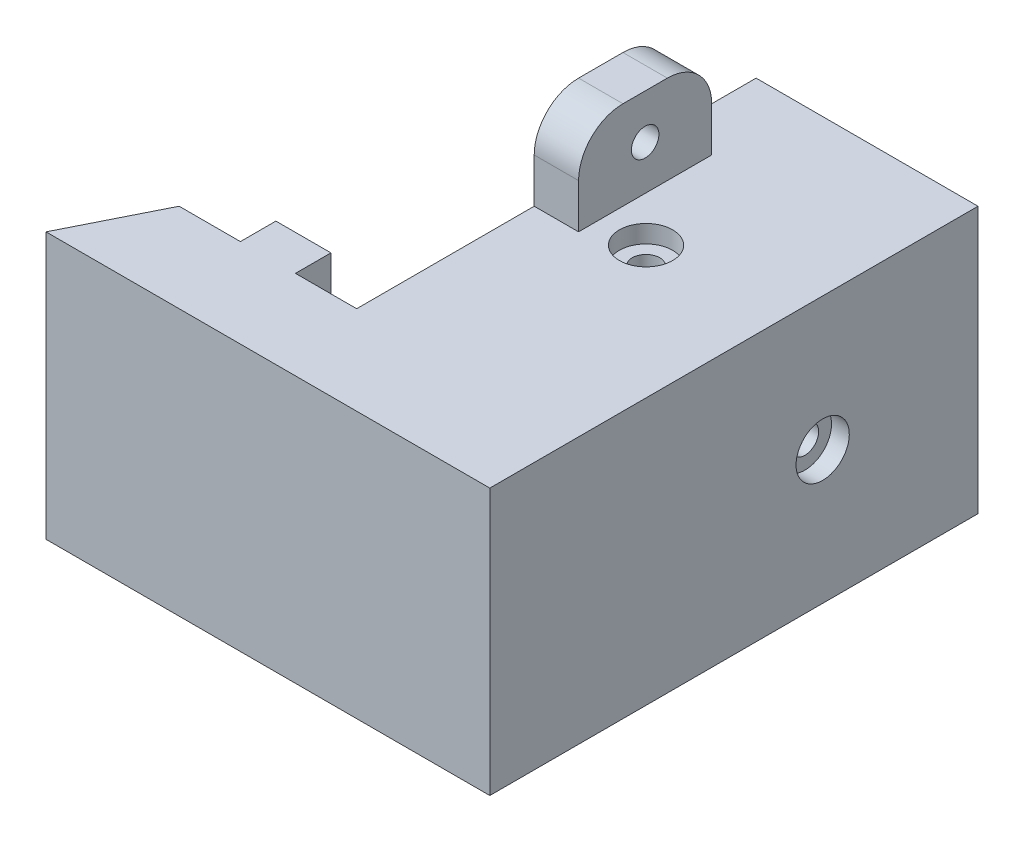
from build123d import *

# Parameters (mm, degrees)
EXTRUDE_1_DEPTH      = 14
CUT_EXTRUDE_1_DEPTH  = 44
SKETCH_8_W           = 5
SKETCH_8_H           = 44
CUT_EXTRUDE_2_DEPTH  = 10
SKETCH_9_W           = 25
SKETCH_9_H           = 44
EXTRUDE_2_DEPTH      = 10
SKETCH_10_W          = 50
SKETCH_10_H          = 7
CUT_EXTRUDE_3_DEPTH  = 10
SKETCH_11_W          = 6.2
SKETCH_11_H          = 7
CUT_EXTRUDE_4_DEPTH  = 10
SKETCH_12_W          = 5
SKETCH_12_H          = 5
SKETCH_12_W_2        = 20
SKETCH_12_H_2        = 20
EXTRUDE_3_DEPTH      = 45
SKETCH_13_W          = 5
SKETCH_13_H          = 7.5
EXTRUDE_4_DEPTH      = 10
SKETCH_14_W          = 15
SKETCH_14_H          = 10
EXTRUDE_5_DEPTH      = 5
SKETCH_15_R          = 1.55
CUT_EXTRUDE_5_DEPTH  = 5
CUT_EXTRUDE_6_DEPTH  = 5
CUT_EXTRUDE_7_DEPTH  = 5
EXTRUDE_6_DEPTH      = 5
EXTRUDE_START        = -5
EXTRUDE_7_DEPTH      = 5
SKETCH_20_W          = 0.2
SKETCH_20_H          = 20
CUT_EXTRUDE_8_DEPTH  = 45
CUT_EXTRUDE_START    = -100
CUT_EXTRUDE_9_DEPTH  = 100
CUT_EXTRUDE_10_DEPTH = 100
SKETCH_24_R          = 1.55
CUT_EXTRUDE_11_DEPTH = 100
SKETCH_25_R          = 3
SKETCH_25_R_2        = 1.55
CUT_EXTRUDE_12_DEPTH = 2
CUT_EXTRUDE_START_2  = -2
SKETCH_26_R          = 3
CUT_EXTRUDE_13_DEPTH = 2
CUT_EXTRUDE_14_DEPTH = 5
SKETCH_28_R          = 3
CUT_EXTRUDE_15_DEPTH = 2


with BuildPart() as part:
    # 草图1 → 凸台-拉伸1 (new body)
    with BuildSketch(Plane.XY):
        Polygon((-15, 22), (-15, -22), (15, -22), (15, 22), (0, 22), align=None)
    extrude(amount=EXTRUDE_1_DEPTH)

    # 草图2 → 切除-拉伸1 (cut)
    with BuildSketch(Plane(origin=(0, 22, 0), x_dir=(1, 0, 0), z_dir=(0, 1, 0))):
        Polygon((-15, 0), (-15, -14), (-10, -4), (-3.1, -4), (-3.1, 0), align=None)
        Polygon((3.1, -4), (10, -4), (15, -14), (15, 0), (3.1, 0), align=None)
    extrude(amount=-CUT_EXTRUDE_1_DEPTH, mode=Mode.SUBTRACT)

    # 草图8 → 切除-拉伸2 (cut)
    with BuildSketch(Plane(origin=(0, 0, 4), x_dir=(-1, 0, 0), z_dir=(0, 0, -1))):
        with Locations((-12.5, 0)):
            Rectangle(SKETCH_8_W, SKETCH_8_H)
    extrude(amount=-CUT_EXTRUDE_2_DEPTH, mode=Mode.SUBTRACT)

    # 草图9 → 凸台-拉伸2 (add)
    with BuildSketch(Plane(origin=(0, 0, 4), x_dir=(-1, 0, 0), z_dir=(0, 0, -1))):
        with Locations((-22.5, 0)):
            Rectangle(SKETCH_9_W, SKETCH_9_H)
    extrude(amount=-EXTRUDE_2_DEPTH)

    # 草图10 → 切除-拉伸3 (cut)
    with BuildSketch(Plane(origin=(0, 0, 4), x_dir=(-1, 0, 0), z_dir=(0, 0, -1))):
        with Locations((-10, -18.5)):
            Rectangle(SKETCH_10_W, SKETCH_10_H)
        with Locations((-10, 18.5)):
            Rectangle(SKETCH_10_W, SKETCH_10_H)
    extrude(amount=-CUT_EXTRUDE_3_DEPTH, mode=Mode.SUBTRACT)

    # 草图11 → 切除-拉伸4 (cut)
    with BuildSketch(Plane(origin=(0, 0, 0), x_dir=(-1, 0, 0), z_dir=(0, 0, -1))):
        with Locations((0, 18.5)):
            Rectangle(SKETCH_11_W, SKETCH_11_H)
        with Locations((0, -18.5)):
            Rectangle(SKETCH_11_W, SKETCH_11_H)
    extrude(amount=-CUT_EXTRUDE_4_DEPTH, mode=Mode.SUBTRACT)

    # 草图12 → 凸台-拉伸3 (add)
    with BuildSketch(Plane(origin=(0, 0, 4), x_dir=(-1, 0, 0), z_dir=(0, 0, -1))):
        with Locations((-32.5, 12.5)):
            Rectangle(SKETCH_12_W, SKETCH_12_H)
        with Locations((-20, 12.5)):
            Rectangle(SKETCH_12_W_2, SKETCH_12_H)
        with Locations((-32.5, 0)):
            Rectangle(SKETCH_12_W, SKETCH_12_H_2)
        with Locations((-32.5, -12.5)):
            Rectangle(SKETCH_12_W, SKETCH_12_H)
        with Locations((-20, -12.5)):
            Rectangle(SKETCH_12_W_2, SKETCH_12_H)
    extrude(amount=EXTRUDE_3_DEPTH)

    # 草图13 → 凸台-拉伸4 (add)
    with BuildSketch(Plane(origin=(0, 15, 0), x_dir=(1, 0, 0), z_dir=(0, 1, 0))):
        with Locations((12.5, 27.25)):
            Rectangle(SKETCH_13_W, SKETCH_13_H)
        with Locations((12.5, 19.75)):
            Rectangle(SKETCH_13_W, SKETCH_13_H)
    extrude(amount=EXTRUDE_4_DEPTH)

    # 草图14 → 凸台-拉伸5 (add)
    with BuildSketch(Plane.ZY.offset(-10)):
        with Locations((-23.5, -20)):
            Rectangle(SKETCH_14_W, SKETCH_14_H)
    extrude(amount=-EXTRUDE_5_DEPTH)

    # 草图15 → 切除-拉伸5 (cut)
    with BuildSketch(Plane.ZY.offset(-10)):
        with Locations((-23.5, 20)):
            Circle(SKETCH_15_R)
        with Locations((-23.5, -20)):
            Circle(SKETCH_15_R)
    extrude(amount=-CUT_EXTRUDE_5_DEPTH, mode=Mode.SUBTRACT)

    # 草图16 → 切除-拉伸6 (cut)
    with BuildSketch(Plane.ZY.offset(-10)):
        with BuildLine():
            Line((-31, 25), (-31, 20))
            ThreePointArc((-31, 20), (-29.535533906, 23.535533906), (-26, 25))
            Line((-26, 25), (-31, 25))
        make_face()
        with BuildLine():
            Line((-16, 25), (-21, 25))
            ThreePointArc((-21, 25), (-17.464466094, 23.535533906), (-16, 20))
            Line((-16, 20), (-16, 25))
        make_face()
    extrude(amount=-CUT_EXTRUDE_6_DEPTH, mode=Mode.SUBTRACT)

    # 草图17 → 切除-拉伸7 (cut)
    with BuildSketch(Plane.ZY.offset(-10)):
        with BuildLine():
            ThreePointArc((-26, -25), (-29.535533906, -23.535533906), (-31, -20))
            Line((-31, -20), (-31, -25))
            Line((-31, -25), (-26, -25))
        make_face()
        with BuildLine():
            ThreePointArc((-16, -20), (-17.464466094, -23.535533906), (-21, -25))
            Line((-21, -25), (-16, -25))
            Line((-16, -25), (-16, -20))
        make_face()
    extrude(amount=-CUT_EXTRUDE_7_DEPTH, mode=Mode.SUBTRACT)

    # 草图18 → 凸台-拉伸6 (add)
    with BuildSketch(Plane.XZ.offset(15)):
        with BuildLine():
            Line((10, -41), (10, -31))
            ThreePointArc((10, -31), (7.071067812, -38.071067812), (0, -41))
            Line((0, -41), (10, -41))
        make_face()
    extrude(amount=-EXTRUDE_6_DEPTH)

    # 草图19 → 凸台-拉伸7 (add)
    with BuildSketch(Plane(origin=(0, 15, 0), x_dir=(1, 0, 0), z_dir=(0, 1, 0)).offset(EXTRUDE_START)):
        with BuildLine():
            Line((10, 41), (0, 41))
            ThreePointArc((0, 41), (7.071067812, 38.071067812), (10, 31))
            Line((10, 31), (10, 41))
        make_face()
    extrude(amount=EXTRUDE_7_DEPTH)

    # 草图20 → 切除-拉伸8 (cut)
    with BuildSketch(Plane(origin=(0, 0, -41), x_dir=(-1, 0, 0), z_dir=(0, 0, -1))):
        with Locations((-30.1, 0)):
            Rectangle(SKETCH_20_W, SKETCH_20_H)
    extrude(amount=-CUT_EXTRUDE_8_DEPTH, mode=Mode.SUBTRACT)

    # 草图21 → 切除-拉伸9 (cut)
    with BuildSketch(Plane(origin=(0, 15, 0), x_dir=(1, 0, 0), z_dir=(0, 1, 0)).offset(CUT_EXTRUDE_START)):
        with BuildLine():
            Line((10, 41), (0, 41))
            ThreePointArc((0, 41), (7.071067812, 38.071067812), (10, 31))
            Line((10, 31), (10, 41))
        make_face()
    extrude(amount=CUT_EXTRUDE_9_DEPTH, mode=Mode.SUBTRACT)

    # 草图23 → 切除-拉伸10 (cut)
    with BuildSketch(Plane.XZ.offset(-10)):
        with BuildLine():
            ThreePointArc((21.65, -18.5), (21.401225478, -17.657793223), (20.73475838, -17.085934302))
            Line((20.73475838, -17.085934302), (19.46524162, -19.914065698))
            ThreePointArc((19.46524162, -19.914065698), (20.942206777, -19.801225478), (21.65, -18.5))
        make_face()
        with BuildLine():
            Line((19.46524162, -19.914065698), (20.73475838, -17.085934302))
            ThreePointArc((20.73475838, -17.085934302), (18.685934302, -17.86524162), (19.46524162, -19.914065698))
        make_face()
    extrude(amount=-CUT_EXTRUDE_10_DEPTH, mode=Mode.SUBTRACT)

    # 草图24 → 切除-拉伸11 (cut)
    with BuildSketch(Plane(origin=(0, 15, 0), x_dir=(1, 0, 0), z_dir=(0, 1, 0)).offset(CUT_EXTRUDE_START)):
        with Locations(Location((20.1, 18.5, 0), (0, 0, 90))):
            Circle(SKETCH_24_R)
    extrude(amount=CUT_EXTRUDE_11_DEPTH, mode=Mode.SUBTRACT)

    # 草图25 → 切除-拉伸12 (cut)
    with BuildSketch(Plane.XZ.offset(15)):
        with Locations(Location((20.1, -18.5, 0), (0, 0, 270))):
            Circle(SKETCH_25_R)
        with Locations(Location((20.1, -18.5, 0), (0, 0, 90))):
            Circle(SKETCH_25_R_2, mode=Mode.SUBTRACT)
    extrude(amount=-CUT_EXTRUDE_12_DEPTH, mode=Mode.SUBTRACT)

    # 草图26 → 切除-拉伸13 (cut)
    with BuildSketch(Plane(origin=(0, 15, 0), x_dir=(1, 0, 0), z_dir=(0, 1, 0)).offset(CUT_EXTRUDE_START_2)):
        with Locations(Location((20.1, 18.5, 0), (0, 0, 90))):
            Circle(SKETCH_26_R)
    extrude(amount=CUT_EXTRUDE_13_DEPTH, mode=Mode.SUBTRACT)

    # 草图27 → 切除-拉伸14 (cut)
    with BuildSketch(Plane(origin=(35, 0, 0), x_dir=(0, 0, -1), z_dir=(1, 0, 0))):
        with BuildLine():
            ThreePointArc((25.05, 0), (24.596015511, 1.096015511), (23.5, 1.55))
            Line((23.5, 1.55), (23.5, 0))
            Line((23.5, 0), (25.05, 0))
        make_face()
        with BuildLine():
            Line((25.05, 0), (23.5, 0))
            Line((23.5, 0), (23.5, -1.55))
            ThreePointArc((23.5, -1.55), (24.596015511, -1.096015511), (25.05, 0))
        make_face()
        with BuildLine():
            Line((23.5, 0), (23.5, 1.55))
            ThreePointArc((23.5, 1.55), (21.95, 0), (23.5, -1.55))
            Line((23.5, -1.55), (23.5, 0))
        make_face()
    extrude(amount=-CUT_EXTRUDE_14_DEPTH, mode=Mode.SUBTRACT)

    # 草图28 → 切除-拉伸15 (cut)
    with BuildSketch(Plane(origin=(35, 0, 0), x_dir=(0, 0, -1), z_dir=(1, 0, 0))):
        with Locations(Location((23.5, 0, 0), (0, 0, 90))):
            Circle(SKETCH_28_R)
    extrude(amount=-CUT_EXTRUDE_15_DEPTH, mode=Mode.SUBTRACT)


solid = part.part
